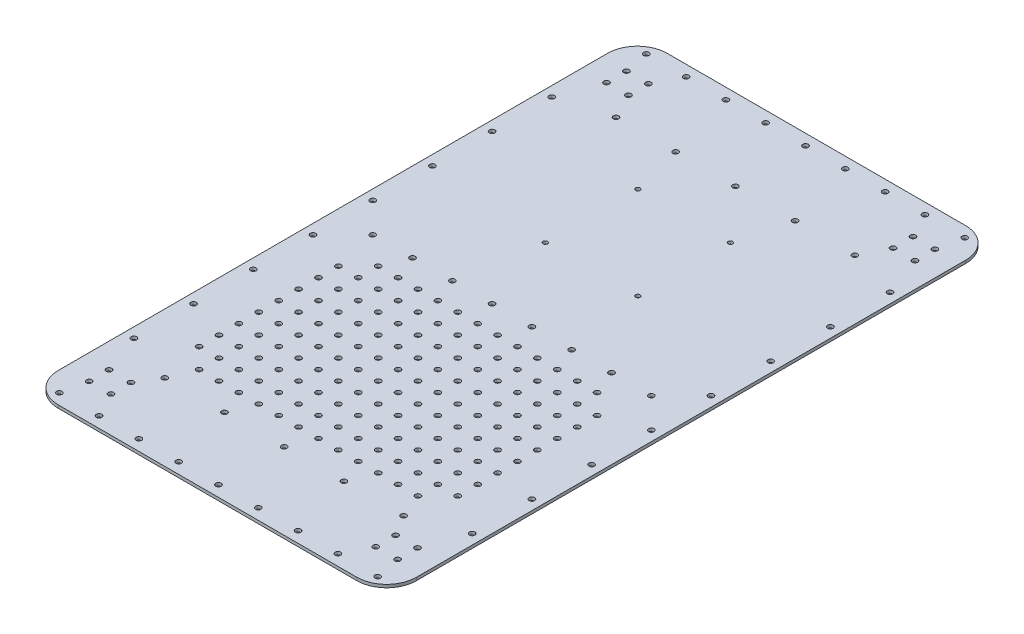
from build123d import *

# Parameters (mm, degrees)
SKETCH1_W               = 360
SKETCH1_H               = 612
SKETCH1_R               = 2.75
BOSS_EXTRUDE1_DEPTH     = 3
SKETCH_1_R              = 2.75
CUT_EXTRUDE_1_DEPTH     = 356.028167897
SKETCH2_R               = 2.75
CUT_EXTRUDE1_DEPTH      = 356.028167897
FILLET1_R               = 30
CUT_EXTRUDE2_DEPTH      = 356.028167897
CUT_EXTRUDE2_DEPTH_BACK = 356.028167897
SKETCH3_R               = 2.25
SKETCH5_R               = 2.75
CUT_EXTRUDE3_DEPTH      = 356.028167897


with BuildPart() as part:
    # Sketch1 → Boss-Extrude1 (new body)
    with BuildSketch(Plane(origin=(0, 0, 0), x_dir=(1, 0, 0), z_dir=(0, 1, 0))):
        Rectangle(SKETCH1_W, SKETCH1_H)
        with Locations(Location((133, -250, 0), (0, 0, 270))):
            Circle(SKETCH1_R, mode=Mode.SUBTRACT)
        with Locations(Location((155, -250, 0), (0, 0, 270))):
            Circle(SKETCH1_R, mode=Mode.SUBTRACT)
        with Locations(Location((133, -270, 0), (0, 0, 270))):
            Circle(SKETCH1_R, mode=Mode.SUBTRACT)
        with Locations(Location((155, -270, 0), (0, 0, 270))):
            Circle(SKETCH1_R, mode=Mode.SUBTRACT)
        with Locations(Location((155, 270, 0), (0, 0, 90))):
            Circle(SKETCH1_R, mode=Mode.SUBTRACT)
        with Locations(Location((133, 270, 0), (0, 0, 90))):
            Circle(SKETCH1_R, mode=Mode.SUBTRACT)
        with Locations(Location((155, 250, 0), (0, 0, 90))):
            Circle(SKETCH1_R, mode=Mode.SUBTRACT)
        with Locations(Location((133, 250, 0), (0, 0, 90))):
            Circle(SKETCH1_R, mode=Mode.SUBTRACT)
        with Locations(Location((-155, 250, 0), (0, 0, 270))):
            Circle(SKETCH1_R, mode=Mode.SUBTRACT)
        with Locations(Location((-133, 250, 0), (0, 0, 270))):
            Circle(SKETCH1_R, mode=Mode.SUBTRACT)
        with Locations(Location((-155, 270, 0), (0, 0, 270))):
            Circle(SKETCH1_R, mode=Mode.SUBTRACT)
        with Locations(Location((-133, 270, 0), (0, 0, 270))):
            Circle(SKETCH1_R, mode=Mode.SUBTRACT)
        with Locations(Location((-155, -270, 0), (0, 0, 90))):
            Circle(SKETCH1_R, mode=Mode.SUBTRACT)
        with Locations(Location((-133, -270, 0), (0, 0, 90))):
            Circle(SKETCH1_R, mode=Mode.SUBTRACT)
        with Locations(Location((-155, -250, 0), (0, 0, 90))):
            Circle(SKETCH1_R, mode=Mode.SUBTRACT)
        with Locations(Location((-133, -250, 0), (0, 0, 90))):
            Circle(SKETCH1_R, mode=Mode.SUBTRACT)
    extrude(amount=BOSS_EXTRUDE1_DEPTH)

    # 草图1 → 切除-拉伸1 (cut, through all)
    with BuildSketch(Plane(origin=(0, 3, 0), x_dir=(1, 0, 0), z_dir=(0, 1, 0))):
        with Locations(Location((-170, 210, 0), (0, 0, 270))):
            Circle(SKETCH_1_R)
        with Locations(Location((-170, 150, 0), (0, 0, 270))):
            Circle(SKETCH_1_R)
        with Locations(Location((-170, 90, 0), (0, 0, 270))):
            Circle(SKETCH_1_R)
        with Locations(Location((-170, 30, 0), (0, 0, 270))):
            Circle(SKETCH_1_R)
        with Locations(Location((-170, -30, 0), (0, 0, 270))):
            Circle(SKETCH_1_R)
        with Locations(Location((-170, -90, 0), (0, 0, 270))):
            Circle(SKETCH_1_R)
        with Locations(Location((-170, -150, 0), (0, 0, 270))):
            Circle(SKETCH_1_R)
        with Locations(Location((-170, -210, 0), (0, 0, 270))):
            Circle(SKETCH_1_R)
        with Locations(Location((170, -210, 0), (0, 0, 90))):
            Circle(SKETCH_1_R)
        with Locations(Location((170, -150, 0), (0, 0, 90))):
            Circle(SKETCH_1_R)
        with Locations(Location((170, -90, 0), (0, 0, 90))):
            Circle(SKETCH_1_R)
        with Locations(Location((170, -30, 0), (0, 0, 90))):
            Circle(SKETCH_1_R)
        with Locations(Location((170, 30, 0), (0, 0, 90))):
            Circle(SKETCH_1_R)
        with Locations(Location((170, 90, 0), (0, 0, 90))):
            Circle(SKETCH_1_R)
        with Locations(Location((170, 150, 0), (0, 0, 90))):
            Circle(SKETCH_1_R)
        with Locations(Location((170, 210, 0), (0, 0, 90))):
            Circle(SKETCH_1_R)
    extrude(amount=-CUT_EXTRUDE_1_DEPTH, mode=Mode.SUBTRACT)

    # Sketch2 → Cut-Extrude1 (cut, through all)
    with BuildSketch(Plane(origin=(0, 3, 0), x_dir=(1, 0, 0), z_dir=(0, 1, 0))):
        with Locations(Location((-160, -295, 0), (0, 0, 270))):
            Circle(SKETCH2_R)
        with Locations(Location((-120, -295, 0), (0, 0, 270))):
            Circle(SKETCH2_R)
        with Locations(Location((-80, -295, 0), (0, 0, 270))):
            Circle(SKETCH2_R)
        with Locations(Location((-40, -295, 0), (0, 0, 270))):
            Circle(SKETCH2_R)
        with Locations(Location((0, -295, 0), (0, 0, 270))):
            Circle(SKETCH2_R)
        with Locations(Location((40, -295, 0), (0, 0, 270))):
            Circle(SKETCH2_R)
        with Locations(Location((80, -295, 0), (0, 0, 270))):
            Circle(SKETCH2_R)
        with Locations(Location((120, -295, 0), (0, 0, 270))):
            Circle(SKETCH2_R)
        with Locations(Location((160, -295, 0), (0, 0, 270))):
            Circle(SKETCH2_R)
        with Locations((510, 295)):
            Circle(SKETCH2_R)
        with Locations((470, 295)):
            Circle(SKETCH2_R)
        with Locations((430, 295)):
            Circle(SKETCH2_R)
        with Locations((390, 295)):
            Circle(SKETCH2_R)
        with Locations((350, 295)):
            Circle(SKETCH2_R)
        with Locations((310, 295)):
            Circle(SKETCH2_R)
        with Locations((270, 295)):
            Circle(SKETCH2_R)
        with Locations((230, 295)):
            Circle(SKETCH2_R)
        with Locations((190, 295)):
            Circle(SKETCH2_R)
        with Locations(Location((160, 295, 0), (0, 0, 90))):
            Circle(SKETCH2_R)
        with Locations(Location((120, 295, 0), (0, 0, 90))):
            Circle(SKETCH2_R)
        with Locations(Location((80, 295, 0), (0, 0, 90))):
            Circle(SKETCH2_R)
        with Locations(Location((40, 295, 0), (0, 0, 90))):
            Circle(SKETCH2_R)
        with Locations(Location((0, 295, 0), (0, 0, 90))):
            Circle(SKETCH2_R)
        with Locations(Location((-40, 295, 0), (0, 0, 90))):
            Circle(SKETCH2_R)
        with Locations(Location((-80, 295, 0), (0, 0, 90))):
            Circle(SKETCH2_R)
        with Locations(Location((-120, 295, 0), (0, 0, 90))):
            Circle(SKETCH2_R)
        with Locations(Location((-160, 295, 0), (0, 0, 90))):
            Circle(SKETCH2_R)
        with Locations(Location((-20, 0, 0), (0, 0, 270))):
            Circle(SKETCH2_R)
        with Locations(Location((-60, 0, 0), (0, 0, 270))):
            Circle(SKETCH2_R)
        with Locations(Location((-100, 0, 0), (0, 0, 270))):
            Circle(SKETCH2_R)
        with Locations(Location((-140, 0, 0), (0, 0, 270))):
            Circle(SKETCH2_R)
        with Locations(Location((140, 0, 0), (0, 0, 90))):
            Circle(SKETCH2_R)
        with Locations(Location((100, 0, 0), (0, 0, 90))):
            Circle(SKETCH2_R)
        with Locations(Location((60, 0, 0), (0, 0, 90))):
            Circle(SKETCH2_R)
        with Locations(Location((20, 0, 0), (0, 0, 90))):
            Circle(SKETCH2_R)
    extrude(amount=-CUT_EXTRUDE1_DEPTH, mode=Mode.SUBTRACT)

    # Fillet1
    fillet1_edges = [part.edges().sort_by_distance(p)[0] for p in [
        (180, 1.5, 306),
        (-180, 1.5, 306),
        (-180, 1.5, -306),
        (180, 1.5, -306),
    ]]
    fillet(fillet1_edges, radius=FILLET1_R)

    # Sketch3 → Cut-Extrude2 (cut, two sides: drawn at the far end of the back side and taken through both)
    with BuildSketch(Plane(origin=(0, 3, 0), x_dir=(1, 0, 0), z_dir=(0, 1, 0)).offset(-CUT_EXTRUDE2_DEPTH_BACK)):
        with Locations(Location((-46.5, 173, 0), (0, 0, 270))):
            Circle(SKETCH3_R)
        with Locations(Location((46.5, 173, 0), (0, 0, 270))):
            Circle(SKETCH3_R)
        with Locations(Location((-46.5, 80, 0), (0, 0, 270))):
            Circle(SKETCH3_R)
        with Locations(Location((46.5, 80, 0), (0, 0, 270))):
            Circle(SKETCH3_R)
    extrude(amount=CUT_EXTRUDE2_DEPTH + CUT_EXTRUDE2_DEPTH_BACK, mode=Mode.SUBTRACT)

    # Sketch5 → Cut-Extrude3 (cut, through all)
    with BuildSketch(Plane(origin=(0, 3, 0), x_dir=(1, 0, 0), z_dir=(0, 1, 0))):
        with Locations(Location((-30, -24.5, 0), (0, 0, 270))):
            Circle(SKETCH5_R)
        with Locations(Location((-50, -24.5, 0), (0, 0, 270))):
            Circle(SKETCH5_R)
        with Locations(Location((-70, -24.5, 0), (0, 0, 270))):
            Circle(SKETCH5_R)
        with Locations(Location((-90, -24.5, 0), (0, 0, 270))):
            Circle(SKETCH5_R)
        with Locations(Location((-110, -24.5, 0), (0, 0, 270))):
            Circle(SKETCH5_R)
        with Locations(Location((-30, -44.5, 0), (0, 0, 270))):
            Circle(SKETCH5_R)
        with Locations(Location((-50, -44.5, 0), (0, 0, 270))):
            Circle(SKETCH5_R)
        with Locations(Location((-70, -44.5, 0), (0, 0, 270))):
            Circle(SKETCH5_R)
        with Locations(Location((-90, -44.5, 0), (0, 0, 270))):
            Circle(SKETCH5_R)
        with Locations(Location((-110, -44.5, 0), (0, 0, 270))):
            Circle(SKETCH5_R)
        with Locations(Location((-130, -44.5, 0), (0, 0, 270))):
            Circle(SKETCH5_R)
        with Locations(Location((-30, -64.5, 0), (0, 0, 270))):
            Circle(SKETCH5_R)
        with Locations(Location((-50, -64.5, 0), (0, 0, 270))):
            Circle(SKETCH5_R)
        with Locations(Location((-70, -64.5, 0), (0, 0, 270))):
            Circle(SKETCH5_R)
        with Locations(Location((-90, -64.5, 0), (0, 0, 270))):
            Circle(SKETCH5_R)
        with Locations(Location((-110, -64.5, 0), (0, 0, 270))):
            Circle(SKETCH5_R)
        with Locations(Location((-130, -64.5, 0), (0, 0, 270))):
            Circle(SKETCH5_R)
        with Locations(Location((-30, -84.5, 0), (0, 0, 270))):
            Circle(SKETCH5_R)
        with Locations(Location((-50, -84.5, 0), (0, 0, 270))):
            Circle(SKETCH5_R)
        with Locations(Location((-70, -84.5, 0), (0, 0, 270))):
            Circle(SKETCH5_R)
        with Locations(Location((-90, -84.5, 0), (0, 0, 270))):
            Circle(SKETCH5_R)
        with Locations(Location((-110, -84.5, 0), (0, 0, 270))):
            Circle(SKETCH5_R)
        with Locations(Location((-130, -84.5, 0), (0, 0, 270))):
            Circle(SKETCH5_R)
        with Locations(Location((-30, -104.5, 0), (0, 0, 270))):
            Circle(SKETCH5_R)
        with Locations(Location((-50, -104.5, 0), (0, 0, 270))):
            Circle(SKETCH5_R)
        with Locations(Location((-70, -104.5, 0), (0, 0, 270))):
            Circle(SKETCH5_R)
        with Locations(Location((-90, -104.5, 0), (0, 0, 270))):
            Circle(SKETCH5_R)
        with Locations(Location((-110, -104.5, 0), (0, 0, 270))):
            Circle(SKETCH5_R)
        with Locations(Location((-130, -104.5, 0), (0, 0, 270))):
            Circle(SKETCH5_R)
        with Locations(Location((-30, -124.5, 0), (0, 0, 270))):
            Circle(SKETCH5_R)
        with Locations(Location((-50, -124.5, 0), (0, 0, 270))):
            Circle(SKETCH5_R)
        with Locations(Location((-70, -124.5, 0), (0, 0, 270))):
            Circle(SKETCH5_R)
        with Locations(Location((-90, -124.5, 0), (0, 0, 270))):
            Circle(SKETCH5_R)
        with Locations(Location((-110, -124.5, 0), (0, 0, 270))):
            Circle(SKETCH5_R)
        with Locations(Location((-130, -124.5, 0), (0, 0, 270))):
            Circle(SKETCH5_R)
        with Locations(Location((-30, -144.5, 0), (0, 0, 270))):
            Circle(SKETCH5_R)
        with Locations(Location((-50, -144.5, 0), (0, 0, 270))):
            Circle(SKETCH5_R)
        with Locations(Location((-70, -144.5, 0), (0, 0, 270))):
            Circle(SKETCH5_R)
        with Locations(Location((-90, -144.5, 0), (0, 0, 270))):
            Circle(SKETCH5_R)
        with Locations(Location((-110, -144.5, 0), (0, 0, 270))):
            Circle(SKETCH5_R)
        with Locations(Location((-130, -144.5, 0), (0, 0, 270))):
            Circle(SKETCH5_R)
        with Locations(Location((-30, -164.5, 0), (0, 0, 270))):
            Circle(SKETCH5_R)
        with Locations(Location((-50, -164.5, 0), (0, 0, 270))):
            Circle(SKETCH5_R)
        with Locations(Location((-70, -164.5, 0), (0, 0, 270))):
            Circle(SKETCH5_R)
        with Locations(Location((-90, -164.5, 0), (0, 0, 270))):
            Circle(SKETCH5_R)
        with Locations(Location((-110, -164.5, 0), (0, 0, 270))):
            Circle(SKETCH5_R)
        with Locations(Location((-130, -164.5, 0), (0, 0, 270))):
            Circle(SKETCH5_R)
        with Locations(Location((-30, -184.5, 0), (0, 0, 270))):
            Circle(SKETCH5_R)
        with Locations(Location((-50, -184.5, 0), (0, 0, 270))):
            Circle(SKETCH5_R)
        with Locations(Location((-70, -184.5, 0), (0, 0, 270))):
            Circle(SKETCH5_R)
        with Locations(Location((-90, -184.5, 0), (0, 0, 270))):
            Circle(SKETCH5_R)
        with Locations(Location((-110, -184.5, 0), (0, 0, 270))):
            Circle(SKETCH5_R)
        with Locations(Location((-130, -184.5, 0), (0, 0, 270))):
            Circle(SKETCH5_R)
        with Locations(Location((-10, -24.5, 0), (0, 0, 270))):
            Circle(SKETCH5_R)
        with Locations(Location((-10, -44.5, 0), (0, 0, 270))):
            Circle(SKETCH5_R)
        with Locations(Location((-10, -64.5, 0), (0, 0, 270))):
            Circle(SKETCH5_R)
        with Locations(Location((-10, -84.5, 0), (0, 0, 270))):
            Circle(SKETCH5_R)
        with Locations(Location((-10, -104.5, 0), (0, 0, 270))):
            Circle(SKETCH5_R)
        with Locations(Location((-10, -124.5, 0), (0, 0, 270))):
            Circle(SKETCH5_R)
        with Locations(Location((-10, -144.5, 0), (0, 0, 270))):
            Circle(SKETCH5_R)
        with Locations(Location((-10, -164.5, 0), (0, 0, 270))):
            Circle(SKETCH5_R)
        with Locations(Location((-10, -184.5, 0), (0, 0, 270))):
            Circle(SKETCH5_R)
        with Locations(Location((10, -184.5, 0), (0, 0, 90))):
            Circle(SKETCH5_R)
        with Locations(Location((10, -164.5, 0), (0, 0, 90))):
            Circle(SKETCH5_R)
        with Locations(Location((10, -144.5, 0), (0, 0, 90))):
            Circle(SKETCH5_R)
        with Locations(Location((10, -124.5, 0), (0, 0, 90))):
            Circle(SKETCH5_R)
        with Locations(Location((10, -104.5, 0), (0, 0, 90))):
            Circle(SKETCH5_R)
        with Locations(Location((10, -84.5, 0), (0, 0, 90))):
            Circle(SKETCH5_R)
        with Locations(Location((10, -64.5, 0), (0, 0, 90))):
            Circle(SKETCH5_R)
        with Locations(Location((10, -44.5, 0), (0, 0, 90))):
            Circle(SKETCH5_R)
        with Locations(Location((10, -24.5, 0), (0, 0, 90))):
            Circle(SKETCH5_R)
        with Locations(Location((130, -184.5, 0), (0, 0, 90))):
            Circle(SKETCH5_R)
        with Locations(Location((110, -184.5, 0), (0, 0, 90))):
            Circle(SKETCH5_R)
        with Locations(Location((90, -184.5, 0), (0, 0, 90))):
            Circle(SKETCH5_R)
        with Locations(Location((70, -184.5, 0), (0, 0, 90))):
            Circle(SKETCH5_R)
        with Locations(Location((50, -184.5, 0), (0, 0, 90))):
            Circle(SKETCH5_R)
        with Locations(Location((30, -184.5, 0), (0, 0, 90))):
            Circle(SKETCH5_R)
        with Locations(Location((130, -164.5, 0), (0, 0, 90))):
            Circle(SKETCH5_R)
        with Locations(Location((110, -164.5, 0), (0, 0, 90))):
            Circle(SKETCH5_R)
        with Locations(Location((90, -164.5, 0), (0, 0, 90))):
            Circle(SKETCH5_R)
        with Locations(Location((70, -164.5, 0), (0, 0, 90))):
            Circle(SKETCH5_R)
        with Locations(Location((50, -164.5, 0), (0, 0, 90))):
            Circle(SKETCH5_R)
        with Locations(Location((30, -164.5, 0), (0, 0, 90))):
            Circle(SKETCH5_R)
        with Locations(Location((130, -144.5, 0), (0, 0, 90))):
            Circle(SKETCH5_R)
        with Locations(Location((110, -144.5, 0), (0, 0, 90))):
            Circle(SKETCH5_R)
        with Locations(Location((90, -144.5, 0), (0, 0, 90))):
            Circle(SKETCH5_R)
        with Locations(Location((70, -144.5, 0), (0, 0, 90))):
            Circle(SKETCH5_R)
        with Locations(Location((50, -144.5, 0), (0, 0, 90))):
            Circle(SKETCH5_R)
        with Locations(Location((30, -144.5, 0), (0, 0, 90))):
            Circle(SKETCH5_R)
        with Locations(Location((130, -124.5, 0), (0, 0, 90))):
            Circle(SKETCH5_R)
        with Locations(Location((110, -124.5, 0), (0, 0, 90))):
            Circle(SKETCH5_R)
        with Locations(Location((90, -124.5, 0), (0, 0, 90))):
            Circle(SKETCH5_R)
        with Locations(Location((70, -124.5, 0), (0, 0, 90))):
            Circle(SKETCH5_R)
        with Locations(Location((50, -124.5, 0), (0, 0, 90))):
            Circle(SKETCH5_R)
        with Locations(Location((30, -124.5, 0), (0, 0, 90))):
            Circle(SKETCH5_R)
        with Locations(Location((130, -104.5, 0), (0, 0, 90))):
            Circle(SKETCH5_R)
        with Locations(Location((110, -104.5, 0), (0, 0, 90))):
            Circle(SKETCH5_R)
        with Locations(Location((90, -104.5, 0), (0, 0, 90))):
            Circle(SKETCH5_R)
        with Locations(Location((70, -104.5, 0), (0, 0, 90))):
            Circle(SKETCH5_R)
        with Locations(Location((50, -104.5, 0), (0, 0, 90))):
            Circle(SKETCH5_R)
        with Locations(Location((30, -104.5, 0), (0, 0, 90))):
            Circle(SKETCH5_R)
        with Locations(Location((130, -84.5, 0), (0, 0, 90))):
            Circle(SKETCH5_R)
        with Locations(Location((110, -84.5, 0), (0, 0, 90))):
            Circle(SKETCH5_R)
        with Locations(Location((90, -84.5, 0), (0, 0, 90))):
            Circle(SKETCH5_R)
        with Locations(Location((70, -84.5, 0), (0, 0, 90))):
            Circle(SKETCH5_R)
        with Locations(Location((50, -84.5, 0), (0, 0, 90))):
            Circle(SKETCH5_R)
        with Locations(Location((30, -84.5, 0), (0, 0, 90))):
            Circle(SKETCH5_R)
        with Locations(Location((130, -64.5, 0), (0, 0, 90))):
            Circle(SKETCH5_R)
        with Locations(Location((110, -64.5, 0), (0, 0, 90))):
            Circle(SKETCH5_R)
        with Locations(Location((90, -64.5, 0), (0, 0, 90))):
            Circle(SKETCH5_R)
        with Locations(Location((70, -64.5, 0), (0, 0, 90))):
            Circle(SKETCH5_R)
        with Locations(Location((50, -64.5, 0), (0, 0, 90))):
            Circle(SKETCH5_R)
        with Locations(Location((30, -64.5, 0), (0, 0, 90))):
            Circle(SKETCH5_R)
        with Locations(Location((130, -44.5, 0), (0, 0, 90))):
            Circle(SKETCH5_R)
        with Locations(Location((110, -44.5, 0), (0, 0, 90))):
            Circle(SKETCH5_R)
        with Locations(Location((90, -44.5, 0), (0, 0, 90))):
            Circle(SKETCH5_R)
        with Locations(Location((70, -44.5, 0), (0, 0, 90))):
            Circle(SKETCH5_R)
        with Locations(Location((50, -44.5, 0), (0, 0, 90))):
            Circle(SKETCH5_R)
        with Locations(Location((30, -44.5, 0), (0, 0, 90))):
            Circle(SKETCH5_R)
        with Locations(Location((110, -24.5, 0), (0, 0, 90))):
            Circle(SKETCH5_R)
        with Locations(Location((90, -24.5, 0), (0, 0, 90))):
            Circle(SKETCH5_R)
        with Locations(Location((70, -24.5, 0), (0, 0, 90))):
            Circle(SKETCH5_R)
        with Locations(Location((50, -24.5, 0), (0, 0, 90))):
            Circle(SKETCH5_R)
        with Locations(Location((30, -24.5, 0), (0, 0, 90))):
            Circle(SKETCH5_R)
        with Locations(Location((-10, -204.5, 0), (0, 0, 270))):
            Circle(SKETCH5_R)
        with Locations(Location((-30, -204.5, 0), (0, 0, 270))):
            Circle(SKETCH5_R)
        with Locations(Location((-50, -204.5, 0), (0, 0, 270))):
            Circle(SKETCH5_R)
        with Locations(Location((-70, -204.5, 0), (0, 0, 270))):
            Circle(SKETCH5_R)
        with Locations(Location((-90, -204.5, 0), (0, 0, 270))):
            Circle(SKETCH5_R)
        with Locations(Location((-110, -204.5, 0), (0, 0, 270))):
            Circle(SKETCH5_R)
        with Locations(Location((110, -204.5, 0), (0, 0, 90))):
            Circle(SKETCH5_R)
        with Locations(Location((90, -204.5, 0), (0, 0, 90))):
            Circle(SKETCH5_R)
        with Locations(Location((70, -204.5, 0), (0, 0, 90))):
            Circle(SKETCH5_R)
        with Locations(Location((50, -204.5, 0), (0, 0, 90))):
            Circle(SKETCH5_R)
        with Locations(Location((30, -204.5, 0), (0, 0, 90))):
            Circle(SKETCH5_R)
        with Locations(Location((10, -204.5, 0), (0, 0, 90))):
            Circle(SKETCH5_R)
        with Locations(Location((120, 224.5, 0), (0, 0, 90))):
            Circle(SKETCH5_R)
        with Locations(Location((0, 224.5, 0), (0, 0, 90))):
            Circle(SKETCH5_R)
        with Locations(Location((-60, 224.5, 0), (0, 0, 90))):
            Circle(SKETCH5_R)
        with Locations(Location((-120, 224.5, 0), (0, 0, 90))):
            Circle(SKETCH5_R)
        with Locations(Location((60, 224.5, 0), (0, 0, 90))):
            Circle(SKETCH5_R)
        with Locations(Location((0, -229, 0), (0, 0, 270))):
            Circle(SKETCH5_R)
        with Locations(Location((-60, -229, 0), (0, 0, 270))):
            Circle(SKETCH5_R)
        with Locations(Location((-120, -229, 0), (0, 0, 270))):
            Circle(SKETCH5_R)
        with Locations(Location((120, -229, 0), (0, 0, 90))):
            Circle(SKETCH5_R)
        with Locations(Location((60, -229, 0), (0, 0, 90))):
            Circle(SKETCH5_R)
    extrude(amount=-CUT_EXTRUDE3_DEPTH, mode=Mode.SUBTRACT)


solid = part.part
